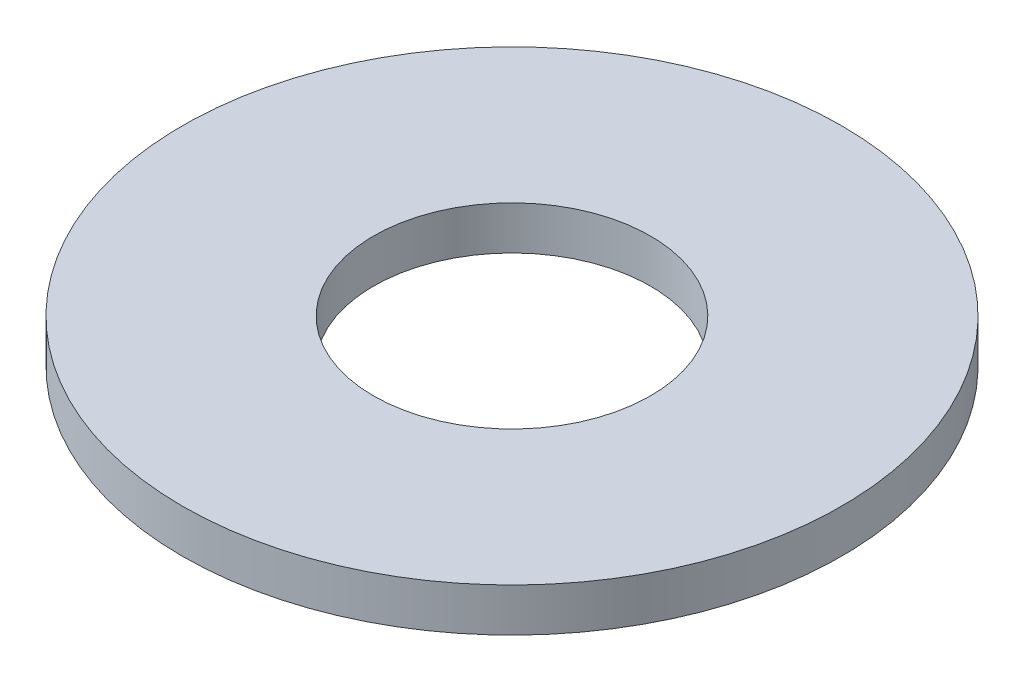
from build123d import *

# Parameters (mm, degrees)
SKETCH1_R           = 37.95
SKETCH1_R_2         = 15.95
BOSS_EXTRUDE1_DEPTH = 5


with BuildPart() as part:
    # Sketch1 → Boss-Extrude1 (new body)
    with BuildSketch(Plane(origin=(0, 0, 0), x_dir=(1, 0, 0), z_dir=(0, 1, 0))):
        with Locations(Location((0, 0, 0), (0, 0, 270))):
            Circle(SKETCH1_R)
        with Locations(Location((0, 0, 0), (0, 0, 270))):
            Circle(SKETCH1_R_2, mode=Mode.SUBTRACT)
    extrude(amount=BOSS_EXTRUDE1_DEPTH)


solid = part.part
